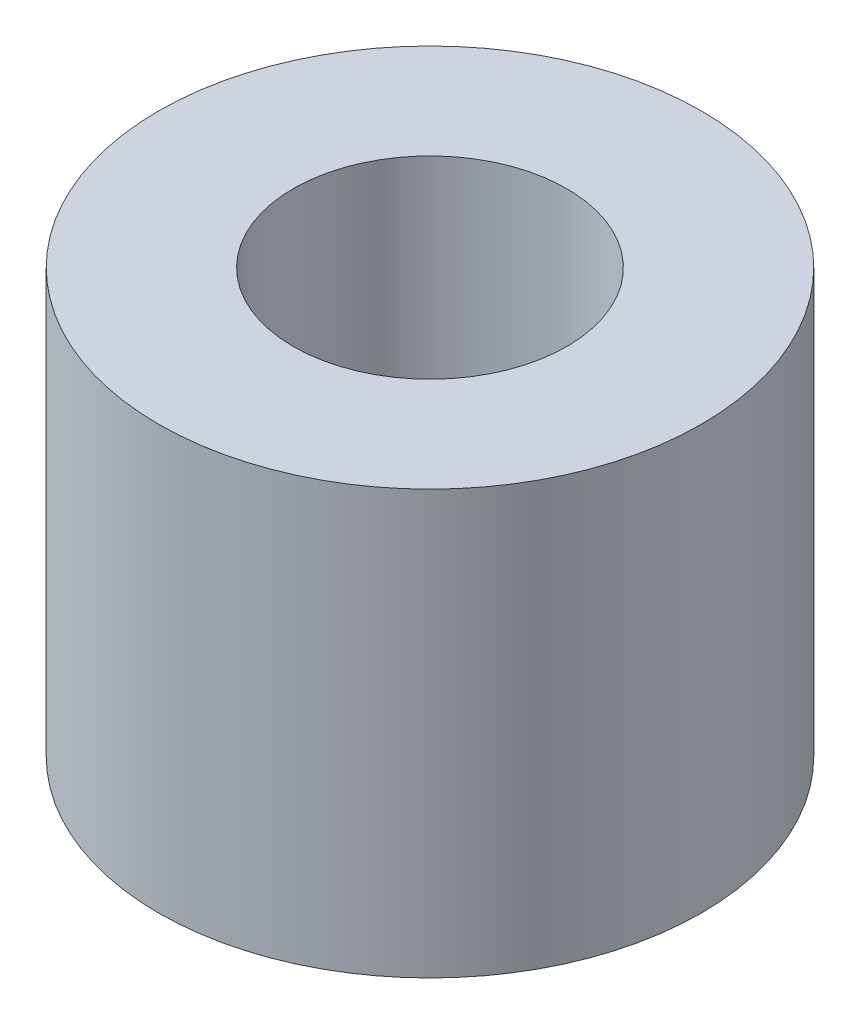
from build123d import *

# Parameters (mm, degrees)
SKETCH1_R           = 6.25
SKETCH1_R_2         = 3.15
BOSS_EXTRUDE1_DEPTH = 9.75


with BuildPart() as part:
    # Sketch1 → Boss-Extrude1 (new body)
    with BuildSketch(Plane(origin=(0, 0, 0), x_dir=(1, 0, 0), z_dir=(0, 1, 0))):
        with Locations(Location((0, 0, 0), (0, 0, 270))):
            Circle(SKETCH1_R)
        with Locations(Location((0, 0, 0), (0, 0, 270))):
            Circle(SKETCH1_R_2, mode=Mode.SUBTRACT)
    extrude(amount=BOSS_EXTRUDE1_DEPTH)


solid = part.part
